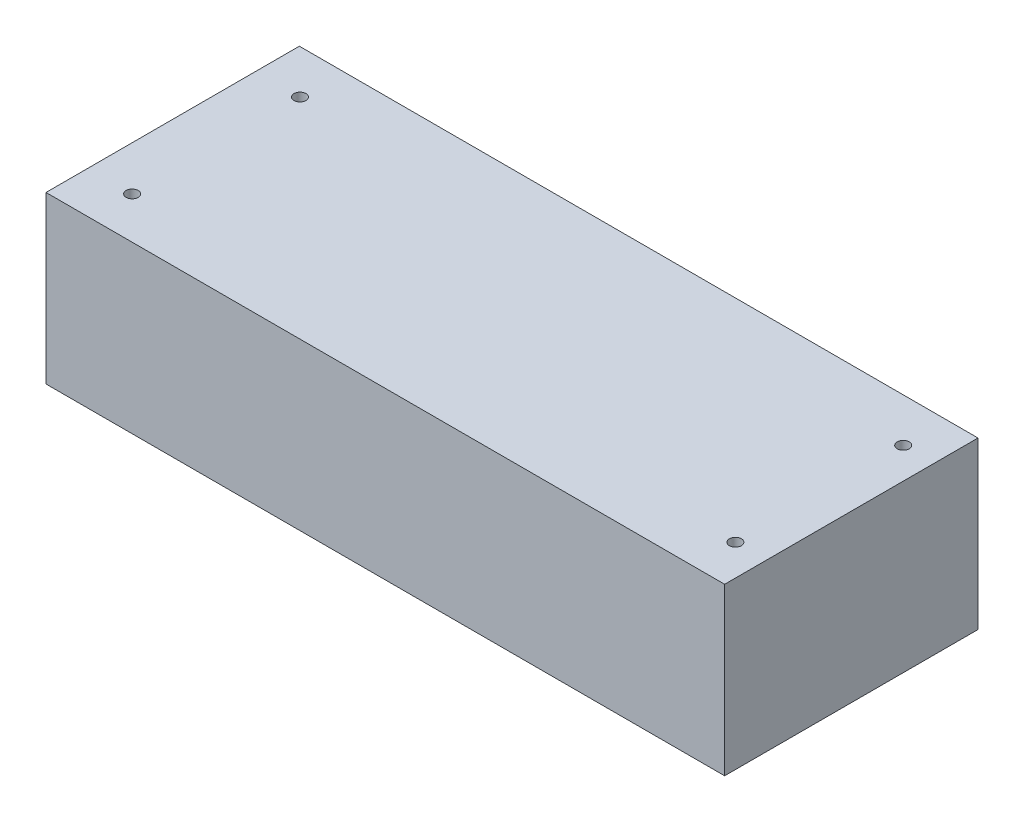
from build123d import *

# Parameters (mm, degrees)
SKETCH1_W           = 225
SKETCH1_H           = 55
BOSS_EXTRUDE1_DEPTH = 84
SHELL1_T            = -4
SKETCH2_R           = 2
CUT_EXTRUDE1_DEPTH  = 246.523929587


with BuildPart() as part:
    # Sketch1 → Boss-Extrude1 (new body)
    with BuildSketch(Plane.XY):
        with Locations((112.5, -27.5)):
            Rectangle(SKETCH1_W, SKETCH1_H)
    extrude(amount=BOSS_EXTRUDE1_DEPTH)

    # Shell1
    shell1_openings = [part.faces().sort_by_distance(p)[0] for p in [
        (0, -27.5, 42),
    ]]
    offset(amount=SHELL1_T, openings=shell1_openings, kind=Kind.INTERSECTION)

    # Sketch2 → Cut-Extrude1 (cut, through all)
    with BuildSketch(Plane.XZ.offset(4)):
        with Locations(Location((14.707468467, 70.14380551, 0), (0, 0, 270))):
            Circle(SKETCH2_R)
        with Locations(Location((14.707468467, 14.5, 0), (0, 0, 270))):
            Circle(SKETCH2_R)
        with Locations(Location((214.707468467, 70.14380551, 0), (0, 0, 270))):
            Circle(SKETCH2_R)
        with Locations(Location((214.707468467, 14.5, 0), (0, 0, 270))):
            Circle(SKETCH2_R)
    extrude(amount=-CUT_EXTRUDE1_DEPTH, mode=Mode.SUBTRACT)


solid = part.part
